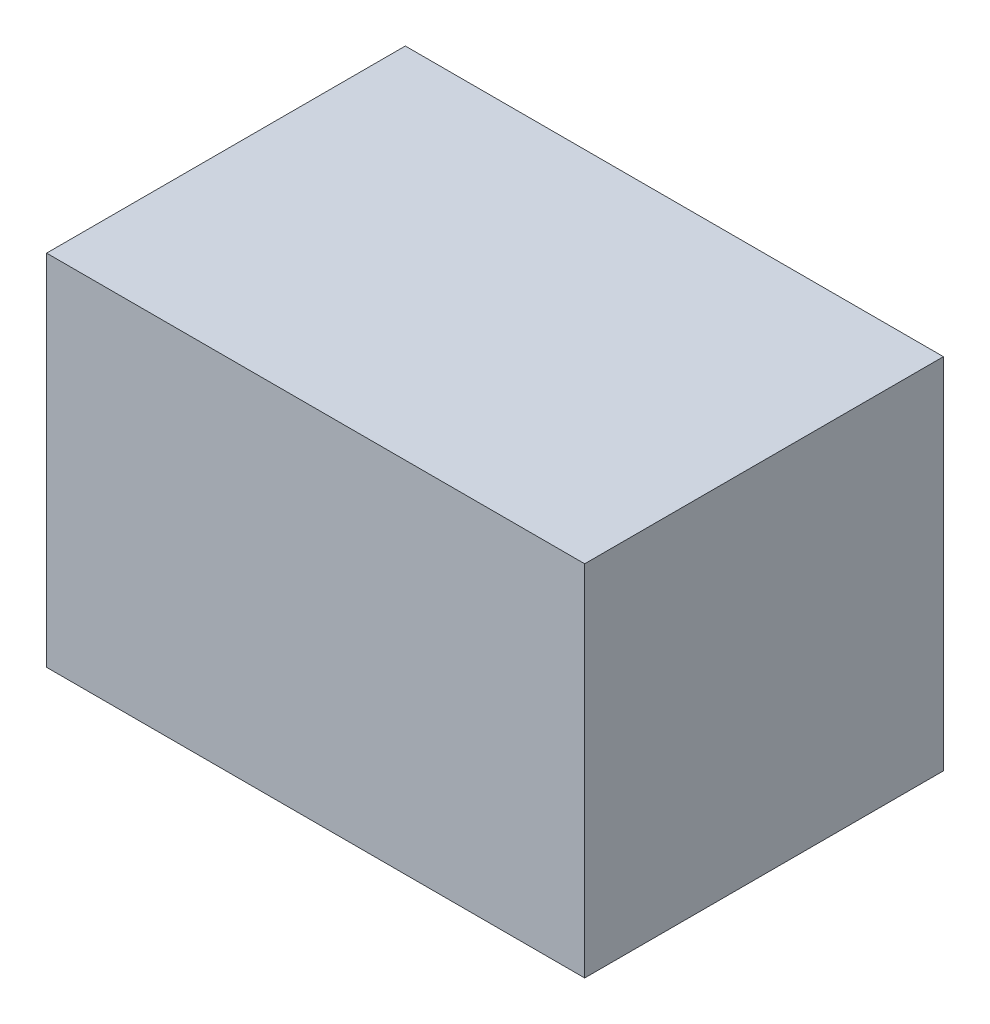
from build123d import *

# Parameters (mm, degrees)
SKETCH_1_W      = 60
SKETCH_1_H      = 40
EXTRUDE_1_DEPTH = 40


with BuildPart() as part:
    # 草图1 → 凸台-拉伸1 (new body)
    with BuildSketch(Plane.XY):
        Rectangle(SKETCH_1_W, SKETCH_1_H)
    extrude(amount=EXTRUDE_1_DEPTH)


solid = part.part
